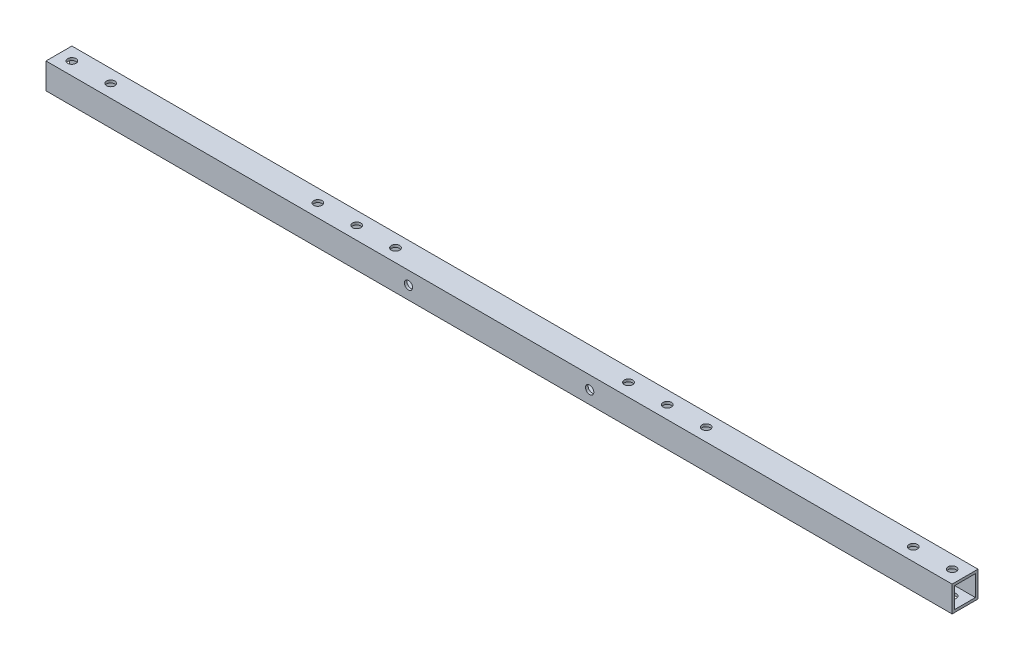
from build123d import *

# Parameters (mm, degrees)
SKETCH_1_W          = 10
SKETCH_1_H          = 10
EXTRUDE_1_DEPTH     = 175
SKETCH_2_W          = 8
SKETCH_2_H          = 8
CUT_EXTRUDE_1_DEPTH = 351.071421284
SKETCH_3_R          = 1.6
CUT_EXTRUDE_2_DEPTH = 176.356779168
SKETCH_4_R          = 1.6
CUT_EXTRUDE_3_DEPTH = 176.356779168
SKETCH_5_R          = 1.6
CUT_EXTRUDE_4_DEPTH = 176.356779168


with BuildPart() as part:
    # ｽｹｯﾁ1 → ﾎﾞｽ - 押し出し1 (new, symmetric)
    with BuildSketch(Plane(origin=(0, 0, 0), x_dir=(0, 0, -1), z_dir=(1, 0, 0))):
        Rectangle(SKETCH_1_W, SKETCH_1_H)
    extrude(amount=EXTRUDE_1_DEPTH, both=True)

    # ｽｹｯﾁ2 → ｶｯﾄ - 押し出し1 (cut, through all)
    with BuildSketch(Plane(origin=(175, 0, 0), x_dir=(0, 0, -1), z_dir=(1, 0, 0))):
        Rectangle(SKETCH_2_W, SKETCH_2_H)
    extrude(amount=-CUT_EXTRUDE_1_DEPTH, mode=Mode.SUBTRACT)

    # ｽｹｯﾁ3 → ｶｯﾄ - 押し出し2 (cut, through all)
    with BuildSketch(Plane(origin=(0, 5, 0), x_dir=(1, 0, 0), z_dir=(0, 1, 0))):
        with Locations((-170, 0)):
            Circle(SKETCH_3_R)
        with Locations((-155, 0)):
            Circle(SKETCH_3_R)
        with Locations((170, 0)):
            Circle(SKETCH_3_R)
        with Locations((155, 0)):
            Circle(SKETCH_3_R)
    extrude(amount=-CUT_EXTRUDE_2_DEPTH, mode=Mode.SUBTRACT)

    # ｽｹｯﾁ4 → ｶｯﾄ - 押し出し3 (cut, through all)
    with BuildSketch(Plane(origin=(0, 5, 0), x_dir=(1, 0, 0), z_dir=(0, 1, 0))):
        with Locations((-75, 0)):
            Circle(SKETCH_4_R)
        with Locations((-60, 0)):
            Circle(SKETCH_4_R)
        with Locations((-45, 0)):
            Circle(SKETCH_4_R)
        with Locations((45, 0)):
            Circle(SKETCH_4_R)
        with Locations((60, 0)):
            Circle(SKETCH_4_R)
        with Locations((75, 0)):
            Circle(SKETCH_4_R)
    extrude(amount=-CUT_EXTRUDE_3_DEPTH, mode=Mode.SUBTRACT)

    # ｽｹｯﾁ5 → ｶｯﾄ - 押し出し4 (cut, through all)
    with BuildSketch(Plane.XY.offset(5)):
        with Locations((-35, 0)):
            Circle(SKETCH_5_R)
        with Locations((35, 0)):
            Circle(SKETCH_5_R)
    extrude(amount=-CUT_EXTRUDE_4_DEPTH, mode=Mode.SUBTRACT)


solid = part.part
